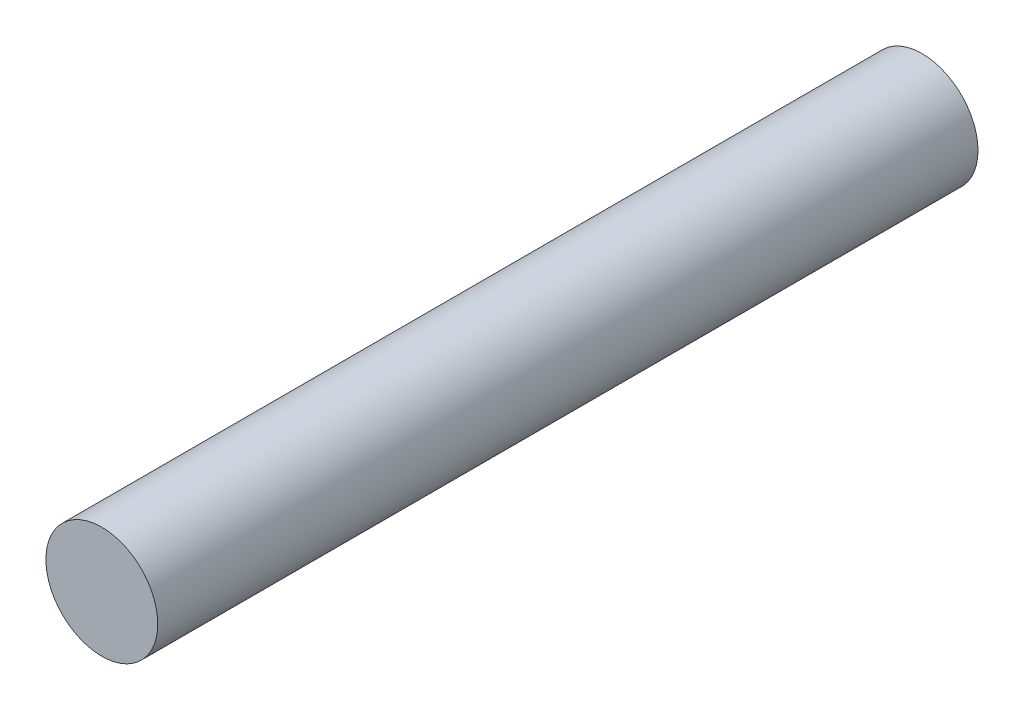
from build123d import *

# Parameters (mm, degrees)
SKETCH1_R           = 3.75
BOSS_EXTRUDE1_DEPTH = 27.5


with BuildPart() as part:
    # Sketch1 → Boss-Extrude1 (new, symmetric)
    with BuildSketch(Plane.XY):
        Circle(SKETCH1_R)
    extrude(amount=BOSS_EXTRUDE1_DEPTH, both=True)


solid = part.part
